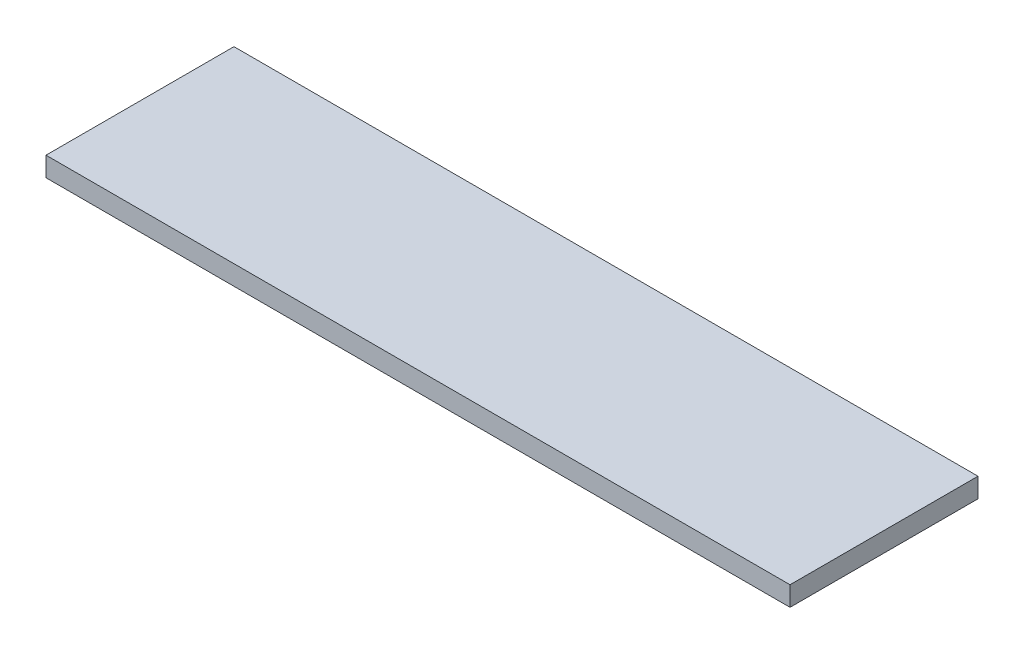
from build123d import *

# Parameters (mm, degrees)
SKETCH1_W           = 4826
SKETCH1_H           = 1219.2
BOSS_EXTRUDE1_DEPTH = 127


with BuildPart() as part:
    # Sketch1 → Boss-Extrude1 (new body)
    with BuildSketch(Plane(origin=(0, 0, 0), x_dir=(1, 0, 0), z_dir=(0, 1, 0))):
        Rectangle(SKETCH1_W, SKETCH1_H)
    extrude(amount=BOSS_EXTRUDE1_DEPTH)


solid = part.part
